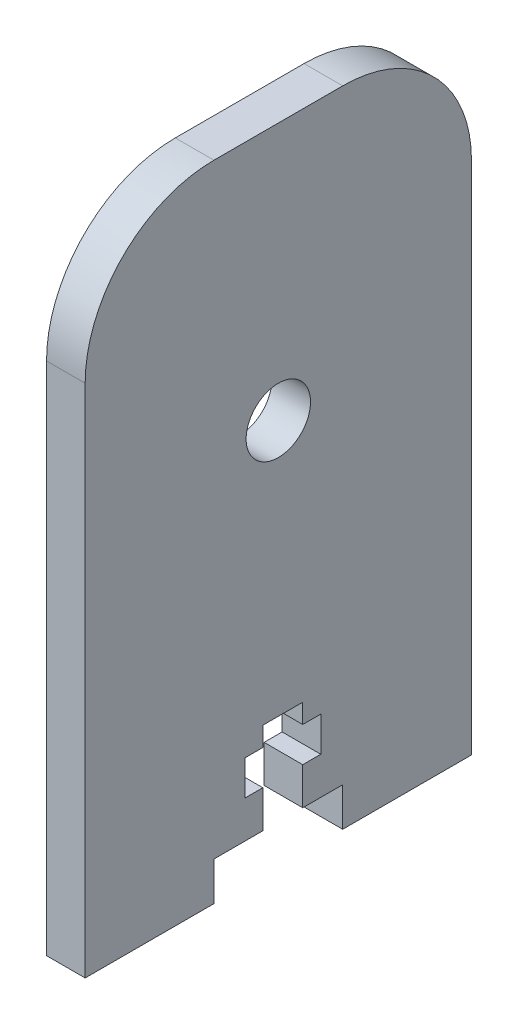
from build123d import *

# Parameters (mm, degrees)
SKETCH1_W                 = 30
SKETCH1_H                 = 50
BOSS_EXTRUDE1_DEPTH       = 3
FILLET1_R                 = 10
SKETCH2_W                 = 10
SKETCH2_H                 = 3
CUT_EXTRUDE1_DEPTH        = 3
F_5_0MM_DOWEL_HOLE1_D     = 5
F_5_0MM_DOWEL_HOLE1_DEPTH = 3
F_5_0MM_DOWEL_HOLE1_TIP   = 1.502151548
CUT_EXTRUDE2_DEPTH        = 3


with BuildPart() as part:
    # Sketch1 → Boss-Extrude1 (new body)
    with BuildSketch(Plane(origin=(0, 0, 0), x_dir=(0, 0, -1), z_dir=(1, 0, 0))):
        with Locations((15, 25)):
            Rectangle(SKETCH1_W, SKETCH1_H)
    extrude(amount=BOSS_EXTRUDE1_DEPTH)

    # Fillet1
    fillet1_edges = [part.edges().sort_by_distance(p)[0] for p in [
        (1.5, 50, 0),
        (1.5, 50, -30),
    ]]
    fillet(fillet1_edges, radius=FILLET1_R)

    # Sketch2 → Cut-Extrude1 (cut)
    with BuildSketch(Plane(origin=(3, 0, 0), x_dir=(0, 0, -1), z_dir=(1, 0, 0))):
        with Locations((15, 1.5)):
            Rectangle(SKETCH2_W, SKETCH2_H)
    extrude(amount=-CUT_EXTRUDE1_DEPTH, mode=Mode.SUBTRACT)

    # Ø5.0mm Dowel Hole1
    with Locations(Plane(origin=(3, 0, 0), x_dir=(0, 0, -1), z_dir=(1, 0, 0))):
        with Locations((15, 30)):
            Hole(F_5_0MM_DOWEL_HOLE1_D / 2, depth=F_5_0MM_DOWEL_HOLE1_DEPTH)
            with Locations((0, 0, -(F_5_0MM_DOWEL_HOLE1_DEPTH + F_5_0MM_DOWEL_HOLE1_TIP / 2))):  # 118° drill point
                Cone(0, F_5_0MM_DOWEL_HOLE1_D / 2, F_5_0MM_DOWEL_HOLE1_TIP, mode=Mode.SUBTRACT)

    # Sketch5 → Cut-Extrude2 (cut)
    with BuildSketch(Plane(origin=(3, 0, 0), x_dir=(0, 0, -1), z_dir=(1, 0, 0))):
        Polygon((13.796178669, 3), (13.796178669, 5.9), (12.396178669, 5.9), (12.396178669, 8.6), (13.796178669, 8.6), (13.796178669, 10.1), (16.896178669, 10.1), (16.896178669, 8.6), (18.296178669, 8.6), (18.296178669, 5.9), (16.896178669, 5.9), (16.896178669, 3), align=None)
    extrude(amount=-CUT_EXTRUDE2_DEPTH, mode=Mode.SUBTRACT)


solid = part.part
